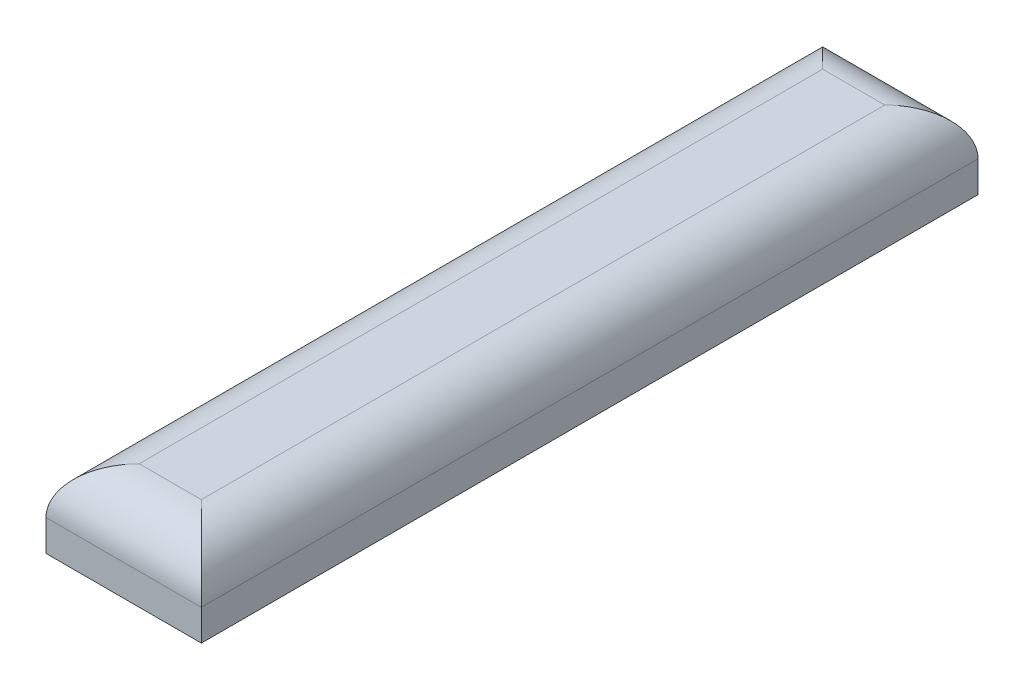
from build123d import *

# Parameters (mm, degrees)
SKETCH1_W           = 25.4
SKETCH1_H           = 127
BOSS_EXTRUDE1_DEPTH = 12.7
FILLET1_R           = 7.62


with BuildPart() as part:
    # Sketch1 → Boss-Extrude1 (new body)
    with BuildSketch(Plane(origin=(0, 0, 0), x_dir=(1, 0, 0), z_dir=(0, 1, 0))):
        Rectangle(SKETCH1_W, SKETCH1_H)
    extrude(amount=BOSS_EXTRUDE1_DEPTH)

    # Fillet1
    fillet1_edges = [part.edges().sort_by_distance(p)[0] for p in [
        (-12.7, 12.7, 0),
        (0, 12.7, 63.5),
        (12.7, 12.7, 0),
        (0, 12.7, -63.5),
    ]]
    fillet(fillet1_edges, radius=FILLET1_R)


solid = part.part
